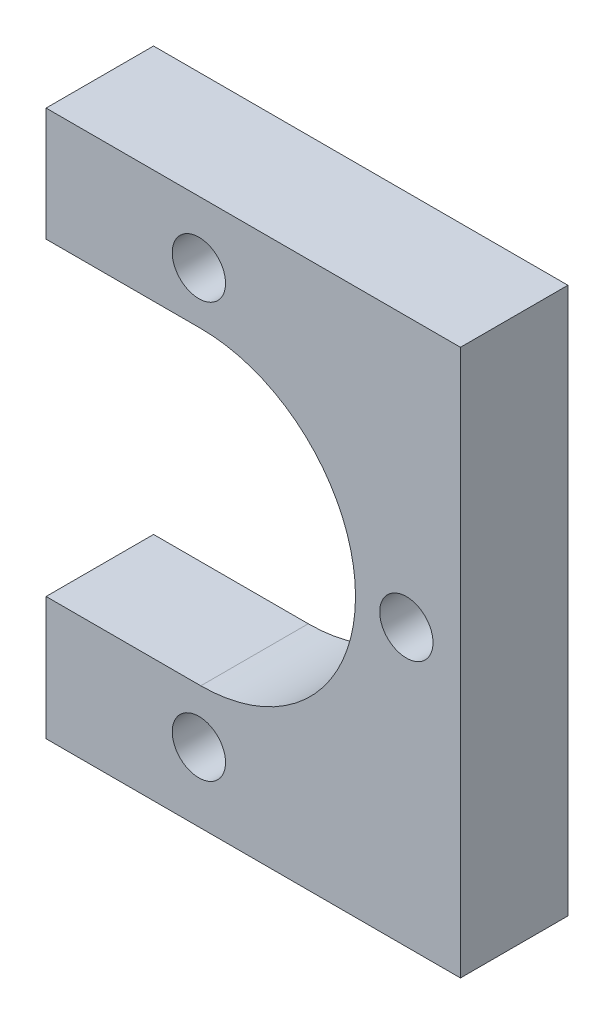
from build123d import *

# Parameters (mm, degrees)
ESBO_O1_W                = 53.82
ESBO_O1_H                = 57.47
RESSALTO_EXTRUS_O1_DEPTH = 11.11
RESSALTO_EXTRUS_O2_DEPTH = 11.11
ESBO_O4_R                = 2.755
CORTE_EXTRUS_O2_DEPTH    = 11.11
ESBO_O3_W                = 53.82
ESBO_O3_H                = 57.47
CORTE_EXTRUS_O3_DEPTH    = 11.11
ESBO_O5_W                = 42.839074837
ESBO_O5_H                = 1
CORTE_EXTRUS_O4_DEPTH    = 11.11


with BuildPart() as part:
    # Esboço1 → Ressalto-extrusão1 (new body)
    with BuildSketch(Plane.XY):
        Rectangle(ESBO_O1_W, ESBO_O1_H)
    extrude(amount=RESSALTO_EXTRUS_O1_DEPTH)

    # Esboço2 → Ressalto-extrusão2 (add)
    with BuildSketch(Plane.XY.offset(11.11)):
        with BuildLine():
            Line((0.065925163, -15.995), (-15.929074837, -15.995))
            Line((-15.929074837, -15.995), (-15.929074837, -28.735))
            Line((-15.929074837, -28.735), (0, -28.735))
            Line((0, -28.735), (26.91, -28.735))
            Line((26.91, -28.735), (26.91, 28.735))
            Line((26.91, 28.735), (0, 28.735))
            Line((0, 28.735), (-15.929074837, 28.735))
            Line((-15.929074837, 28.735), (-15.929074837, 15.995))
            Line((-15.929074837, 15.995), (0.065925163, 15.995))
            ThreePointArc((0.065925163, 15.995), (16.060925163, 0), (0.065925163, -15.995))
        make_face()
    extrude(amount=RESSALTO_EXTRUS_O2_DEPTH)

    # Esboço4 → Corte-extrusão2 (cut)
    with BuildSketch(Plane.XY.offset(22.22)):
        with Locations((21.318136928, -0.131850449)):
            Circle(ESBO_O4_R)
        with Locations((-0.131863072, -21.581850449)):
            Circle(ESBO_O4_R)
        with Locations((-0.131863072, 21.318149551)):
            Circle(ESBO_O4_R)
    extrude(amount=-CORTE_EXTRUS_O2_DEPTH, mode=Mode.SUBTRACT)

    # Esboço3 → Corte-extrusão3 (cut)
    with BuildSketch(Plane(origin=(0, 0, 0), x_dir=(-1, 0, 0), z_dir=(0, 0, -1))):
        Rectangle(ESBO_O3_W, ESBO_O3_H)
    extrude(amount=-CORTE_EXTRUS_O3_DEPTH, mode=Mode.SUBTRACT)

    # Esboço5 → Corte-extrusão4 (cut)
    with BuildSketch(Plane(origin=(0, 0, 11.11), x_dir=(-1, 0, 0), z_dir=(0, 0, -1))):
        with Locations((-5.490462581, 28.235)):
            Rectangle(ESBO_O5_W, ESBO_O5_H)
    extrude(amount=-CORTE_EXTRUS_O4_DEPTH, mode=Mode.SUBTRACT)


solid = part.part
